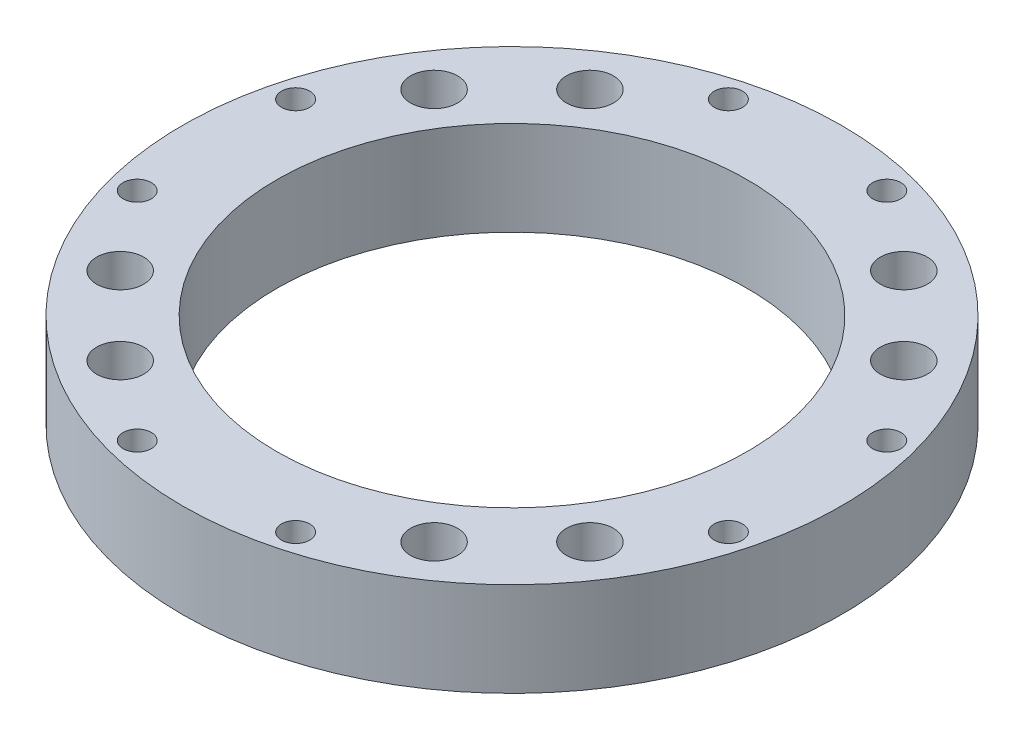
from build123d import *

# Parameters (mm, degrees)
SKETCH1_R           = 35
SKETCH1_R_2         = 25
SKETCH1_R_3         = 1.5
SKETCH1_R_4         = 2.5
BOSS_EXTRUDE1_DEPTH = 10


with BuildPart() as part:
    # Sketch1 → Boss-Extrude1 (new body)
    with BuildSketch(Plane(origin=(0, 0, 0), x_dir=(1, 0, 0), z_dir=(0, 1, 0))):
        with Locations(Location((0, 0, 0), (0, 0, 270))):
            Circle(SKETCH1_R)
        with Locations(Location((0, 0, 0), (0, 0, 270))):
            Circle(SKETCH1_R_2, mode=Mode.SUBTRACT)
        with Locations(Location((-8.411618966, 31.392589354, 0), (0, 0, 270))):
            Circle(SKETCH1_R_3, mode=Mode.SUBTRACT)
        with Locations(Location((8.411618966, 31.392589354, 0), (0, 0, 270))):
            Circle(SKETCH1_R_3, mode=Mode.SUBTRACT)
        with Locations(Location((31.392589354, 8.411618966, 0), (0, 0, 270))):
            Circle(SKETCH1_R_3, mode=Mode.SUBTRACT)
        with Locations(Location((31.392589354, -8.411618966, 0), (0, 0, 270))):
            Circle(SKETCH1_R_3, mode=Mode.SUBTRACT)
        with Locations(Location((8.411618966, -31.392589354, 0), (0, 0, 270))):
            Circle(SKETCH1_R_3, mode=Mode.SUBTRACT)
        with Locations(Location((-8.411618966, -31.392589354, 0), (0, 0, 270))):
            Circle(SKETCH1_R_3, mode=Mode.SUBTRACT)
        with Locations(Location((-31.392589354, -8.411618966, 0), (0, 0, 270))):
            Circle(SKETCH1_R_3, mode=Mode.SUBTRACT)
        with Locations(Location((-31.392589354, 8.411618966, 0), (0, 0, 270))):
            Circle(SKETCH1_R_3, mode=Mode.SUBTRACT)
        with Locations(Location((-24.944088369, 16.667106991, 0), (0, 0, 270))):
            Circle(SKETCH1_R_4, mode=Mode.SUBTRACT)
        with Locations(Location((-16.667106991, 24.944088369, 0), (0, 0, 270))):
            Circle(SKETCH1_R_4, mode=Mode.SUBTRACT)
        with Locations(Location((16.667106991, 24.944088369, 0), (0, 0, 270))):
            Circle(SKETCH1_R_4, mode=Mode.SUBTRACT)
        with Locations(Location((24.944088369, 16.667106991, 0), (0, 0, 270))):
            Circle(SKETCH1_R_4, mode=Mode.SUBTRACT)
        with Locations(Location((24.944088369, -16.667106991, 0), (0, 0, 270))):
            Circle(SKETCH1_R_4, mode=Mode.SUBTRACT)
        with Locations(Location((16.667106991, -24.944088369, 0), (0, 0, 270))):
            Circle(SKETCH1_R_4, mode=Mode.SUBTRACT)
        with Locations(Location((-16.667106991, -24.944088369, 0), (0, 0, 270))):
            Circle(SKETCH1_R_4, mode=Mode.SUBTRACT)
        with Locations(Location((-24.944088369, -16.667106991, 0), (0, 0, 270))):
            Circle(SKETCH1_R_4, mode=Mode.SUBTRACT)
    extrude(amount=BOSS_EXTRUDE1_DEPTH)


solid = part.part
